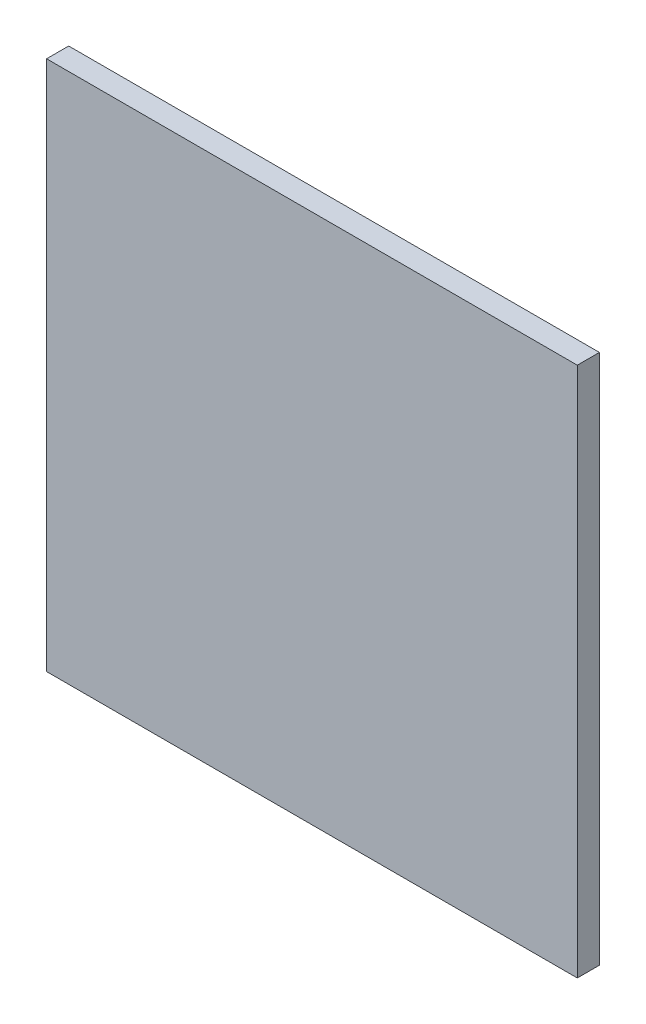
from build123d import *

# Parameters (mm, degrees)
SKETCH1_W           = 3048
SKETCH1_H           = 3048
BOSS_EXTRUDE1_DEPTH = 127


with BuildPart() as part:
    # Sketch1 → Boss-Extrude1 (new body)
    with BuildSketch(Plane.XY):
        Rectangle(SKETCH1_W, SKETCH1_H)
    extrude(amount=BOSS_EXTRUDE1_DEPTH)


solid = part.part
